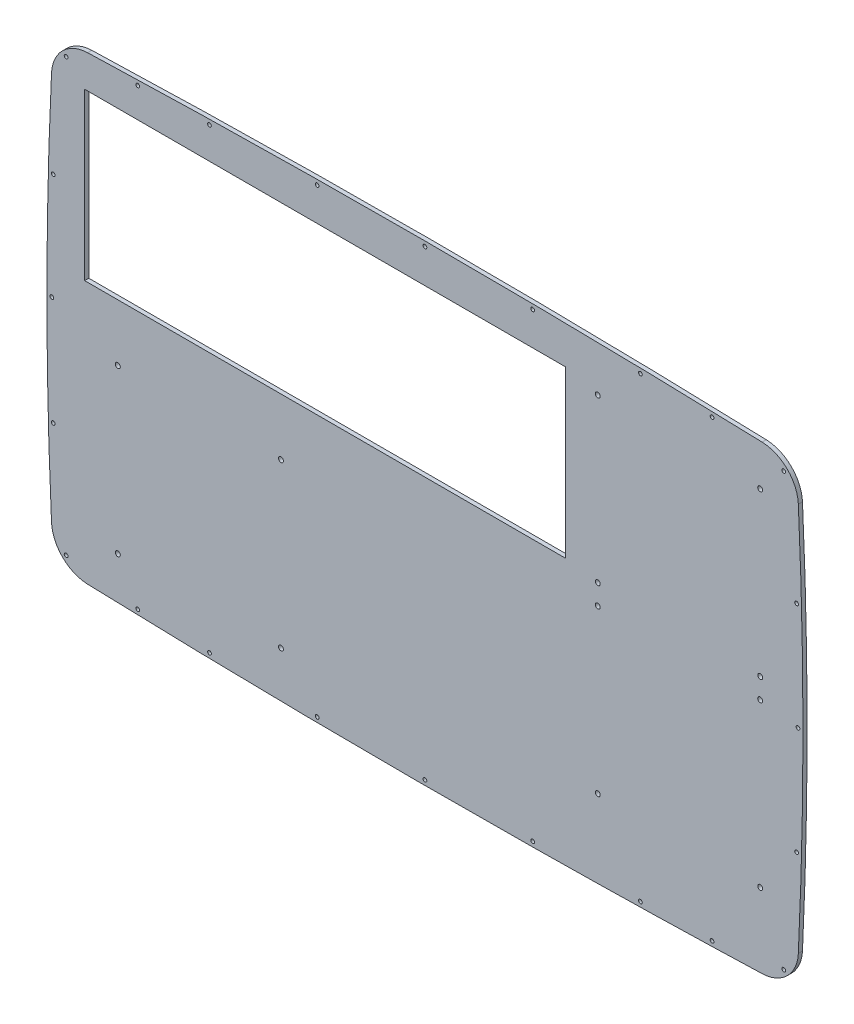
from build123d import *

# Parameters (mm, degrees)
SKETCH1_R           = 1.435
SKETCH1_R_2         = 1.4351
BOSS_EXTRUDE1_DEPTH = 3.175
SKETCH2_W           = 368.3
SKETCH2_H           = 127
CUT_EXTRUDE1_DEPTH  = 342.698968356
SKETCH4_R           = 1.89865
CUT_EXTRUDE2_DEPTH  = 342.698968356
SKETCH5_R           = 1.89865
CUT_EXTRUDE3_DEPTH  = 342.698968356


with BuildPart() as part:
    # Sketch1 → Boss-Extrude1 (new body)
    with BuildSketch(Plane.XY):
        with BuildLine():
            ThreePointArc((2.968751211, -181.189695026), (41.295889155, -181.079537948), (79.6220041, -180.778621425))
            Line((79.6220041, -180.778621425), (85.559165015, -180.714940362))
            ThreePointArc((85.559165015, -180.714940362), (123.887667874, -180.193645916), (162.213100977, -179.481566675))
            ThreePointArc((162.213100977, -179.481566675), (165.18118139, -179.418457741), (168.149237253, -179.35420455))
            ThreePointArc((168.149237253, -179.35420455), (192.659124698, -178.779845314), (217.167059321, -178.127456184))
            ThreePointArc((217.167059321, -178.127456184), (220.135246662, -178.043143258), (223.103401271, -177.957685792))
            Line((223.103401271, -177.957685792), (258.423629847, -176.852835003))
            ThreePointArc((258.423629847, -176.852835003), (267.290868319, -175.133004675), (275.18450496, -170.742533734))
            ThreePointArc((275.18450496, -170.742533734), (277.610750544, -168.6061656), (279.781359306, -166.210504095))
            ThreePointArc((279.781359306, -166.210504095), (284.283709644, -158.379432473), (286.129131597, -149.53685032))
            ThreePointArc((286.129131597, -149.53685032), (287.482131945, -117.828809116), (288.512976487, -86.108660213))
            ThreePointArc((288.512976487, -86.108660213), (288.592974065, -83.139049998), (288.670148028, -80.169365063))
            ThreePointArc((288.670148028, -80.169365063), (289.416235277, -41.572865854), (289.685382101, -2.970094485))
            ThreePointArc((289.685382101, -2.970094485), (289.686328933, 0.0005929), (289.684451162, 2.971279842))
            ThreePointArc((289.684451162, 2.971279842), (289.409759592, 41.084465923), (288.670148028, 79.191465063))
            ThreePointArc((288.670148028, 79.191465063), (288.592974065, 82.161149998), (288.512976487, 85.130760213))
            ThreePointArc((288.512976487, 85.130760213), (287.482131945, 116.850909116), (286.129131597, 148.55895032))
            ThreePointArc((286.129131597, 148.55895032), (284.283709644, 157.401532473), (279.781359306, 165.232604095))
            ThreePointArc((279.781359306, 165.232604095), (277.610750544, 167.6282656), (275.18450496, 169.764633734))
            ThreePointArc((275.18450496, 169.764633734), (267.290868319, 174.155104675), (258.423629847, 175.874935003))
            ThreePointArc((258.423629847, 175.874935003), (240.76414932, 176.447620699), (223.103401271, 176.979785792))
            ThreePointArc((223.103401271, 176.979785792), (220.135246662, 177.065243258), (217.167059321, 177.149556184))
            ThreePointArc((217.167059321, 177.149556184), (192.659124698, 177.801945314), (168.149237253, 178.37630455))
            ThreePointArc((168.149237253, 178.37630455), (165.18118139, 178.440557741), (162.213100977, 178.503666675))
            ThreePointArc((162.213100977, 178.503666675), (123.887667874, 179.215745916), (85.559165015, 179.737040362))
            ThreePointArc((85.559165015, 179.737040362), (82.590590695, 179.769453121), (79.6220041, 179.800721425))
            ThreePointArc((79.6220041, 179.800721425), (41.295889155, 180.101637948), (2.968751211, 180.211795026))
            ThreePointArc((2.968751211, 180.211795026), (0, 180.212367286), (-2.968751211, 180.211795026))
            ThreePointArc((-2.968751211, 180.211795026), (-41.295889155, 180.101637948), (-79.6220041, 179.800721425))
            ThreePointArc((-79.6220041, 179.800721425), (-82.590590695, 179.769453121), (-85.559165015, 179.737040362))
            ThreePointArc((-85.559165015, 179.737040362), (-123.887667874, 179.215745916), (-162.213100977, 178.503666675))
            ThreePointArc((-162.213100977, 178.503666675), (-165.18118139, 178.440557741), (-168.149237253, 178.37630455))
            ThreePointArc((-168.149237253, 178.37630455), (-192.659124698, 177.801945314), (-217.167059321, 177.149556184))
            ThreePointArc((-217.167059321, 177.149556184), (-220.135246662, 177.065243258), (-223.103401271, 176.979785792))
            ThreePointArc((-223.103401271, 176.979785792), (-240.76414932, 176.447620699), (-258.423629847, 175.874935003))
            ThreePointArc((-258.423629847, 175.874935003), (-267.290868319, 174.155104675), (-275.18450496, 169.764633734))
            ThreePointArc((-275.18450496, 169.764633734), (-277.610750544, 167.6282656), (-279.781359306, 165.232604095))
            ThreePointArc((-279.781359306, 165.232604095), (-284.283709644, 157.401532473), (-286.129131597, 148.55895032))
            ThreePointArc((-286.129131597, 148.55895032), (-287.482131945, 116.850909116), (-288.512976487, 85.130760213))
            ThreePointArc((-288.512976487, 85.130760213), (-288.592974065, 82.161149998), (-288.670148028, 79.191465063))
            ThreePointArc((-288.670148028, 79.191465063), (-289.409759592, 41.084465923), (-289.684451162, 2.971279842))
            ThreePointArc((-289.684451162, 2.971279842), (-289.686328933, 0.0005929), (-289.685382101, -2.970094485))
            ThreePointArc((-289.685382101, -2.970094485), (-289.416235277, -41.572865854), (-288.670148028, -80.169365063))
            ThreePointArc((-288.670148028, -80.169365063), (-288.592974065, -83.139049998), (-288.512976487, -86.108660213))
            ThreePointArc((-288.512976487, -86.108660213), (-287.482131945, -117.828809116), (-286.129131597, -149.53685032))
            ThreePointArc((-286.129131597, -149.53685032), (-284.283709644, -158.379432473), (-279.781359306, -166.210504095))
            ThreePointArc((-279.781359306, -166.210504095), (-277.610750544, -168.6061656), (-275.18450496, -170.742533734))
            ThreePointArc((-275.18450496, -170.742533734), (-267.290868319, -175.133004675), (-258.423629847, -176.852835003))
            ThreePointArc((-258.423629847, -176.852835003), (-240.76414932, -177.425520699), (-223.103401271, -177.957685792))
            ThreePointArc((-223.103401271, -177.957685792), (-220.135246662, -178.043143258), (-217.167059321, -178.127456184))
            ThreePointArc((-217.167059321, -178.127456184), (-192.659124698, -178.779845314), (-168.149237253, -179.35420455))
            ThreePointArc((-168.149237253, -179.35420455), (-165.18118139, -179.418457741), (-162.213100977, -179.481566675))
            ThreePointArc((-162.213100977, -179.481566675), (-123.887667874, -180.193645916), (-85.559165015, -180.714940362))
            ThreePointArc((-85.559165015, -180.714940362), (-82.590590695, -180.747353121), (-79.6220041, -180.778621425))
            ThreePointArc((-79.6220041, -180.778621425), (-41.295889155, -181.079537948), (-2.968751211, -181.189695026))
            ThreePointArc((-2.968751211, -181.189695026), (0, -181.190267286), (2.968751211, -181.189695026))
        make_face()
        with Locations((-274.954150451, -165.911566346)):
            Circle(SKETCH1_R, mode=Mode.SUBTRACT)
        with Locations((-220.027075225, -174.260724966)):
            Circle(SKETCH1_R_2, mode=Mode.SUBTRACT)
        with Locations((-165.1, -175.63472853)):
            Circle(SKETCH1_R_2, mode=Mode.SUBTRACT)
        with Locations((-82.55, -176.962970799)):
            Circle(SKETCH1_R_2, mode=Mode.SUBTRACT)
        with Locations((0, -177.405667286)):
            Circle(SKETCH1_R_2, mode=Mode.SUBTRACT)
        with Locations((-284.81033356, -83.03895)):
            Circle(SKETCH1_R_2, mode=Mode.SUBTRACT)
        with Locations((82.55, -176.962970799)):
            Circle(SKETCH1_R_2, mode=Mode.SUBTRACT)
        with Locations((165.1, -175.63472853)):
            Circle(SKETCH1_R_2, mode=Mode.SUBTRACT)
        with Locations((220.027075225, -174.260724966)):
            Circle(SKETCH1_R_2, mode=Mode.SUBTRACT)
        with Locations((274.954150451, -165.911566346)):
            Circle(SKETCH1_R_2, mode=Mode.SUBTRACT)
        with Locations((284.81033356, -83.03895)):
            Circle(SKETCH1_R_2, mode=Mode.SUBTRACT)
        with Locations((-285.902364234, 0)):
            Circle(SKETCH1_R_2, mode=Mode.SUBTRACT)
        with Locations((-284.81033356, 82.06105)):
            Circle(SKETCH1_R_2, mode=Mode.SUBTRACT)
        with Locations((-274.954150451, 164.933666346)):
            Circle(SKETCH1_R_2, mode=Mode.SUBTRACT)
        with Locations((-220.027075225, 173.282824966)):
            Circle(SKETCH1_R_2, mode=Mode.SUBTRACT)
        with Locations((-165.1, 174.65682853)):
            Circle(SKETCH1_R_2, mode=Mode.SUBTRACT)
        with Locations((-82.55, 175.985070799)):
            Circle(SKETCH1_R_2, mode=Mode.SUBTRACT)
        with Locations((0, 176.427767286)):
            Circle(SKETCH1_R_2, mode=Mode.SUBTRACT)
        with Locations((285.902364234, 0)):
            Circle(SKETCH1_R_2, mode=Mode.SUBTRACT)
        with Locations((284.81033356, 82.06105)):
            Circle(SKETCH1_R_2, mode=Mode.SUBTRACT)
        with Locations((82.55, 175.985070799)):
            Circle(SKETCH1_R_2, mode=Mode.SUBTRACT)
        with Locations((165.1, 174.65682853)):
            Circle(SKETCH1_R_2, mode=Mode.SUBTRACT)
        with Locations((220.027075225, 173.282824966)):
            Circle(SKETCH1_R_2, mode=Mode.SUBTRACT)
        with Locations((274.954150451, 164.933666346)):
            Circle(SKETCH1_R_2, mode=Mode.SUBTRACT)
    extrude(amount=BOSS_EXTRUDE1_DEPTH)

    # Sketch2 → Cut-Extrude1 (cut, through all)
    with BuildSketch(Plane.XY.offset(3.175)):
        with Locations((-76.579131597, 86.974935003)):
            Rectangle(SKETCH2_W, SKETCH2_H)
    extrude(amount=-CUT_EXTRUDE1_DEPTH, mode=Mode.SUBTRACT)

    # Sketch4 → Cut-Extrude2 (cut, through all)
    with BuildSketch(Plane(origin=(0, 0, 0), x_dir=(-1, 0, 0), z_dir=(0, 0, -1))):
        with Locations((-256.919131597, 144.124935003)):
            Circle(SKETCH4_R)
        with Locations((-132.419131597, 144.124935003)):
            Circle(SKETCH4_R)
        with Locations((-256.919131597, 19.624935003)):
            Circle(SKETCH4_R)
        with Locations((-256.919131597, 4.124935003)):
            Circle(SKETCH4_R)
        with Locations((-132.419131597, 19.624935003)):
            Circle(SKETCH4_R)
        with Locations((-132.419131597, 4.124935003)):
            Circle(SKETCH4_R)
        with Locations((-256.919131597, -120.375064997)):
            Circle(SKETCH4_R)
        with Locations((-132.419131597, -120.375064997)):
            Circle(SKETCH4_R)
    extrude(amount=-CUT_EXTRUDE2_DEPTH, mode=Mode.SUBTRACT)

    # Sketch5 → Cut-Extrude3 (cut, through all)
    with BuildSketch(Plane(origin=(0, 0, 0), x_dir=(-1, 0, 0), z_dir=(0, 0, -1))):
        with Locations((235.329131597, -145.102835003)):
            Circle(SKETCH5_R)
        with Locations((110.329131597, -145.102835003)):
            Circle(SKETCH5_R)
        with Locations((110.329131597, -20.102835003)):
            Circle(SKETCH5_R)
        with Locations((235.329131597, -20.102835003)):
            Circle(SKETCH5_R)
    extrude(amount=-CUT_EXTRUDE3_DEPTH, mode=Mode.SUBTRACT)


solid = part.part
